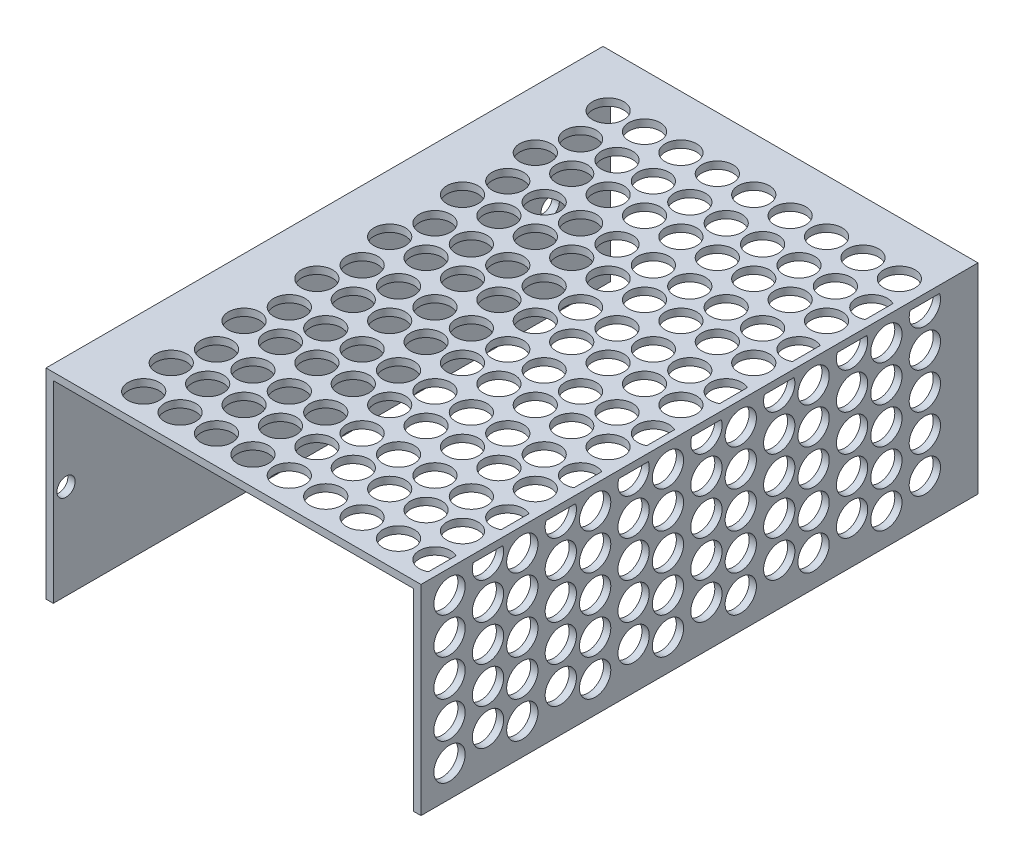
from build123d import *

# Parameters (mm, degrees)
EXTRUDE_1_DEPTH       = 78.5
CUT_EXTRUDE_1_DEPTH   = 99.116002772
SKETCH_3_R            = 2.15
CUT_EXTRUDE_2_DEPTH   = 10
HOLE_WIZARD_M31_D     = 2.5
HOLE_WIZARD_M31_DEPTH = 8.5
HOLE_WIZARD_M31_TIP   = 0.751075774
SKETCH_6_R            = 2.15
CUT_EXTRUDE_3_DEPTH   = 24


with BuildPart() as part:
    # Эскиз1 → Бобышка-Вытянуть1 (new body)
    with BuildSketch(Plane.XY):
        Polygon((50.5, 0), (50.5, 27.5), (1, 27.5), (1, 0), (0, 0), (0, 28.5), (51.5, 28.5), (51.5, 0), align=None)
    extrude(amount=EXTRUDE_1_DEPTH)

    # Эскиз2 → Вырез-Вытянуть1 (cut, through all)
    with BuildSketch(Plane(origin=(51.5, 0, 0), x_dir=(0, 0, -1), z_dir=(1, 0, 0))):
        Polygon((-77.5, 28.5), (-77.5, 1), (-1, 1), (-1, 28.5), (0, 28.5), (0, 0), (-78.5, 0), (-78.5, 28.5), align=None)
    extrude(amount=-CUT_EXTRUDE_1_DEPTH, mode=Mode.SUBTRACT)

    # Эскиз3 → Вырез-Вытянуть2 (cut)
    with BuildSketch(Plane(origin=(0, 28.5, 0), x_dir=(1, 0, 0), z_dir=(0, 1, 0))):
        with Locations(Location((8, -8.3, 0), (0, 0, 270))):
            Circle(SKETCH_3_R)
        with Locations(Location((9.5, -13.582039862, 0), (0, 0, 270))):
            Circle(SKETCH_3_R)
        with Locations(Location((13, -8.3, 0), (0, 0, 270))):
            Circle(SKETCH_3_R)
        with Locations(Location((14.5, -13.582039862, 0), (0, 0, 270))):
            Circle(SKETCH_3_R)
        with Locations(Location((18, -8.3, 0), (0, 0, 270))):
            Circle(SKETCH_3_R)
        with Locations(Location((19.5, -13.582039862, 0), (0, 0, 270))):
            Circle(SKETCH_3_R)
        with Locations(Location((23, -8.3, 0), (0, 0, 270))):
            Circle(SKETCH_3_R)
        with Locations(Location((24.5, -13.582039862, 0), (0, 0, 270))):
            Circle(SKETCH_3_R)
        with Locations(Location((28, -8.3, 0), (0, 0, 270))):
            Circle(SKETCH_3_R)
        with Locations(Location((29.5, -13.582039862, 0), (0, 0, 270))):
            Circle(SKETCH_3_R)
        with Locations(Location((33, -8.3, 0), (0, 0, 270))):
            Circle(SKETCH_3_R)
        with Locations(Location((34.5, -13.582039862, 0), (0, 0, 270))):
            Circle(SKETCH_3_R)
        with Locations(Location((38, -8.3, 0), (0, 0, 270))):
            Circle(SKETCH_3_R)
        with Locations(Location((39.5, -13.582039862, 0), (0, 0, 270))):
            Circle(SKETCH_3_R)
        with Locations(Location((43, -8.3, 0), (0, 0, 270))):
            Circle(SKETCH_3_R)
        with Locations(Location((44.5, -13.582039862, 0), (0, 0, 270))):
            Circle(SKETCH_3_R)
        with Locations(Location((48, -8.3, 0), (0, 0, 270))):
            Circle(SKETCH_3_R)
        with Locations(Location((8, -18.3, 0), (0, 0, 270))):
            Circle(SKETCH_3_R)
        with Locations(Location((9.5, -23.582039862, 0), (0, 0, 270))):
            Circle(SKETCH_3_R)
        with Locations(Location((13, -18.3, 0), (0, 0, 270))):
            Circle(SKETCH_3_R)
        with Locations(Location((14.5, -23.582039862, 0), (0, 0, 270))):
            Circle(SKETCH_3_R)
        with Locations(Location((18, -18.3, 0), (0, 0, 270))):
            Circle(SKETCH_3_R)
        with Locations(Location((19.5, -23.582039862, 0), (0, 0, 270))):
            Circle(SKETCH_3_R)
        with Locations(Location((23, -18.3, 0), (0, 0, 270))):
            Circle(SKETCH_3_R)
        with Locations(Location((24.5, -23.582039862, 0), (0, 0, 270))):
            Circle(SKETCH_3_R)
        with Locations(Location((28, -18.3, 0), (0, 0, 270))):
            Circle(SKETCH_3_R)
        with Locations(Location((29.5, -23.582039862, 0), (0, 0, 270))):
            Circle(SKETCH_3_R)
        with Locations(Location((33, -18.3, 0), (0, 0, 270))):
            Circle(SKETCH_3_R)
        with Locations(Location((34.5, -23.582039862, 0), (0, 0, 270))):
            Circle(SKETCH_3_R)
        with Locations(Location((38, -18.3, 0), (0, 0, 270))):
            Circle(SKETCH_3_R)
        with Locations(Location((39.5, -23.582039862, 0), (0, 0, 270))):
            Circle(SKETCH_3_R)
        with Locations(Location((43, -18.3, 0), (0, 0, 270))):
            Circle(SKETCH_3_R)
        with Locations(Location((44.5, -23.582039862, 0), (0, 0, 270))):
            Circle(SKETCH_3_R)
        with Locations(Location((48, -18.3, 0), (0, 0, 270))):
            Circle(SKETCH_3_R)
        with Locations(Location((8, -28.3, 0), (0, 0, 270))):
            Circle(SKETCH_3_R)
        with Locations(Location((9.5, -33.582039862, 0), (0, 0, 270))):
            Circle(SKETCH_3_R)
        with Locations(Location((13, -28.3, 0), (0, 0, 270))):
            Circle(SKETCH_3_R)
        with Locations(Location((14.5, -33.582039862, 0), (0, 0, 270))):
            Circle(SKETCH_3_R)
        with Locations(Location((18, -28.3, 0), (0, 0, 270))):
            Circle(SKETCH_3_R)
        with Locations(Location((19.5, -33.582039862, 0), (0, 0, 270))):
            Circle(SKETCH_3_R)
        with Locations(Location((23, -28.3, 0), (0, 0, 270))):
            Circle(SKETCH_3_R)
        with Locations(Location((24.5, -33.582039862, 0), (0, 0, 270))):
            Circle(SKETCH_3_R)
        with Locations(Location((28, -28.3, 0), (0, 0, 270))):
            Circle(SKETCH_3_R)
        with Locations(Location((29.5, -33.582039862, 0), (0, 0, 270))):
            Circle(SKETCH_3_R)
        with Locations(Location((33, -28.3, 0), (0, 0, 270))):
            Circle(SKETCH_3_R)
        with Locations(Location((34.5, -33.582039862, 0), (0, 0, 270))):
            Circle(SKETCH_3_R)
        with Locations(Location((38, -28.3, 0), (0, 0, 270))):
            Circle(SKETCH_3_R)
        with Locations(Location((39.5, -33.582039862, 0), (0, 0, 270))):
            Circle(SKETCH_3_R)
        with Locations(Location((43, -28.3, 0), (0, 0, 270))):
            Circle(SKETCH_3_R)
        with Locations(Location((44.5, -33.582039862, 0), (0, 0, 270))):
            Circle(SKETCH_3_R)
        with Locations(Location((48, -28.3, 0), (0, 0, 270))):
            Circle(SKETCH_3_R)
        with Locations(Location((8, -38.3, 0), (0, 0, 270))):
            Circle(SKETCH_3_R)
        with Locations(Location((9.5, -43.582039862, 0), (0, 0, 270))):
            Circle(SKETCH_3_R)
        with Locations(Location((13, -38.3, 0), (0, 0, 270))):
            Circle(SKETCH_3_R)
        with Locations(Location((14.5, -43.582039862, 0), (0, 0, 270))):
            Circle(SKETCH_3_R)
        with Locations(Location((18, -38.3, 0), (0, 0, 270))):
            Circle(SKETCH_3_R)
        with Locations(Location((19.5, -43.582039862, 0), (0, 0, 270))):
            Circle(SKETCH_3_R)
        with Locations(Location((23, -38.3, 0), (0, 0, 270))):
            Circle(SKETCH_3_R)
        with Locations(Location((24.5, -43.582039862, 0), (0, 0, 270))):
            Circle(SKETCH_3_R)
        with Locations(Location((28, -38.3, 0), (0, 0, 270))):
            Circle(SKETCH_3_R)
        with Locations(Location((29.5, -43.582039862, 0), (0, 0, 270))):
            Circle(SKETCH_3_R)
        with Locations(Location((33, -38.3, 0), (0, 0, 270))):
            Circle(SKETCH_3_R)
        with Locations(Location((34.5, -43.582039862, 0), (0, 0, 270))):
            Circle(SKETCH_3_R)
        with Locations(Location((38, -38.3, 0), (0, 0, 270))):
            Circle(SKETCH_3_R)
        with Locations(Location((39.5, -43.582039862, 0), (0, 0, 270))):
            Circle(SKETCH_3_R)
        with Locations(Location((43, -38.3, 0), (0, 0, 270))):
            Circle(SKETCH_3_R)
        with Locations(Location((44.5, -43.582039862, 0), (0, 0, 270))):
            Circle(SKETCH_3_R)
        with Locations(Location((48, -38.3, 0), (0, 0, 270))):
            Circle(SKETCH_3_R)
        with Locations(Location((8, -48.3, 0), (0, 0, 270))):
            Circle(SKETCH_3_R)
        with Locations(Location((9.5, -53.582039862, 0), (0, 0, 270))):
            Circle(SKETCH_3_R)
        with Locations(Location((13, -48.3, 0), (0, 0, 270))):
            Circle(SKETCH_3_R)
        with Locations(Location((14.5, -53.582039862, 0), (0, 0, 270))):
            Circle(SKETCH_3_R)
        with Locations(Location((18, -48.3, 0), (0, 0, 270))):
            Circle(SKETCH_3_R)
        with Locations(Location((19.5, -53.582039862, 0), (0, 0, 270))):
            Circle(SKETCH_3_R)
        with Locations(Location((23, -48.3, 0), (0, 0, 270))):
            Circle(SKETCH_3_R)
        with Locations(Location((24.5, -53.582039862, 0), (0, 0, 270))):
            Circle(SKETCH_3_R)
        with Locations(Location((28, -48.3, 0), (0, 0, 270))):
            Circle(SKETCH_3_R)
        with Locations(Location((29.5, -53.582039862, 0), (0, 0, 270))):
            Circle(SKETCH_3_R)
        with Locations(Location((33, -48.3, 0), (0, 0, 270))):
            Circle(SKETCH_3_R)
        with Locations(Location((34.5, -53.582039862, 0), (0, 0, 270))):
            Circle(SKETCH_3_R)
        with Locations(Location((38, -48.3, 0), (0, 0, 270))):
            Circle(SKETCH_3_R)
        with Locations(Location((39.5, -53.582039862, 0), (0, 0, 270))):
            Circle(SKETCH_3_R)
        with Locations(Location((43, -48.3, 0), (0, 0, 270))):
            Circle(SKETCH_3_R)
        with Locations(Location((44.5, -53.582039862, 0), (0, 0, 270))):
            Circle(SKETCH_3_R)
        with Locations(Location((48, -48.3, 0), (0, 0, 270))):
            Circle(SKETCH_3_R)
        with Locations(Location((8, -58.3, 0), (0, 0, 270))):
            Circle(SKETCH_3_R)
        with Locations(Location((9.5, -63.582039862, 0), (0, 0, 270))):
            Circle(SKETCH_3_R)
        with Locations(Location((13, -58.3, 0), (0, 0, 270))):
            Circle(SKETCH_3_R)
        with Locations(Location((14.5, -63.582039862, 0), (0, 0, 270))):
            Circle(SKETCH_3_R)
        with Locations(Location((18, -58.3, 0), (0, 0, 270))):
            Circle(SKETCH_3_R)
        with Locations(Location((19.5, -63.582039862, 0), (0, 0, 270))):
            Circle(SKETCH_3_R)
        with Locations(Location((23, -58.3, 0), (0, 0, 270))):
            Circle(SKETCH_3_R)
        with Locations(Location((24.5, -63.582039862, 0), (0, 0, 270))):
            Circle(SKETCH_3_R)
        with Locations(Location((28, -58.3, 0), (0, 0, 270))):
            Circle(SKETCH_3_R)
        with Locations(Location((29.5, -63.582039862, 0), (0, 0, 270))):
            Circle(SKETCH_3_R)
        with Locations(Location((33, -58.3, 0), (0, 0, 270))):
            Circle(SKETCH_3_R)
        with Locations(Location((34.5, -63.582039862, 0), (0, 0, 270))):
            Circle(SKETCH_3_R)
        with Locations(Location((38, -58.3, 0), (0, 0, 270))):
            Circle(SKETCH_3_R)
        with Locations(Location((39.5, -63.582039862, 0), (0, 0, 270))):
            Circle(SKETCH_3_R)
        with Locations(Location((43, -58.3, 0), (0, 0, 270))):
            Circle(SKETCH_3_R)
        with Locations(Location((44.5, -63.582039862, 0), (0, 0, 270))):
            Circle(SKETCH_3_R)
        with Locations(Location((48, -58.3, 0), (0, 0, 270))):
            Circle(SKETCH_3_R)
        with Locations(Location((8, -68.3, 0), (0, 0, 270))):
            Circle(SKETCH_3_R)
        with Locations(Location((9.5, -73.582039862, 0), (0, 0, 270))):
            Circle(SKETCH_3_R)
        with Locations(Location((13, -68.3, 0), (0, 0, 270))):
            Circle(SKETCH_3_R)
        with Locations(Location((14.5, -73.582039862, 0), (0, 0, 270))):
            Circle(SKETCH_3_R)
        with Locations(Location((18, -68.3, 0), (0, 0, 270))):
            Circle(SKETCH_3_R)
        with Locations(Location((19.5, -73.582039862, 0), (0, 0, 270))):
            Circle(SKETCH_3_R)
        with Locations(Location((23, -68.3, 0), (0, 0, 270))):
            Circle(SKETCH_3_R)
        with Locations(Location((24.5, -73.582039862, 0), (0, 0, 270))):
            Circle(SKETCH_3_R)
        with Locations(Location((28, -68.3, 0), (0, 0, 270))):
            Circle(SKETCH_3_R)
        with Locations(Location((29.5, -73.582039862, 0), (0, 0, 270))):
            Circle(SKETCH_3_R)
        with Locations(Location((33, -68.3, 0), (0, 0, 270))):
            Circle(SKETCH_3_R)
        with Locations(Location((34.5, -73.582039862, 0), (0, 0, 270))):
            Circle(SKETCH_3_R)
        with Locations(Location((38, -68.3, 0), (0, 0, 270))):
            Circle(SKETCH_3_R)
        with Locations(Location((39.5, -73.582039862, 0), (0, 0, 270))):
            Circle(SKETCH_3_R)
        with Locations(Location((43, -68.3, 0), (0, 0, 270))):
            Circle(SKETCH_3_R)
        with Locations(Location((44.5, -73.582039862, 0), (0, 0, 270))):
            Circle(SKETCH_3_R)
        with Locations(Location((48, -68.3, 0), (0, 0, 270))):
            Circle(SKETCH_3_R)
        with BuildLine():
            Line((50.5, -21.678753231), (50.5, -25.485326493))
            ThreePointArc((50.5, -25.485326493), (47.35, -23.582039862), (50.5, -21.678753231))
        make_face()
        with BuildLine():
            Line((50.5, -31.678753231), (50.5, -35.485326493))
            ThreePointArc((50.5, -35.485326493), (47.35, -33.582039862), (50.5, -31.678753231))
        make_face()
        with BuildLine():
            Line((50.5, -11.678753231), (50.5, -15.485326493))
            ThreePointArc((50.5, -15.485326493), (47.35, -13.582039862), (50.5, -11.678753231))
        make_face()
        with BuildLine():
            Line((50.5, -41.678753231), (50.5, -45.485326493))
            ThreePointArc((50.5, -45.485326493), (47.35, -43.582039862), (50.5, -41.678753231))
        make_face()
        with BuildLine():
            Line((50.5, -51.678753231), (50.5, -55.485326493))
            ThreePointArc((50.5, -55.485326493), (47.35, -53.582039862), (50.5, -51.678753231))
        make_face()
        with BuildLine():
            Line((50.5, -61.678753231), (50.5, -65.485326493))
            ThreePointArc((50.5, -65.485326493), (47.35, -63.582039862), (50.5, -61.678753231))
        make_face()
        with BuildLine():
            Line((50.5, -71.678753231), (50.5, -75.485326493))
            ThreePointArc((50.5, -75.485326493), (47.35, -73.582039862), (50.5, -71.678753231))
        make_face()
    extrude(amount=-CUT_EXTRUDE_2_DEPTH, mode=Mode.SUBTRACT)

    # Отверстие обработанное метчиком M31
    with Locations(Plane.ZY):
        with Locations((75.75, 14), (9.25, 14)):
            Hole(HOLE_WIZARD_M31_D / 2, depth=HOLE_WIZARD_M31_DEPTH)
            with Locations((0, 0, -(HOLE_WIZARD_M31_DEPTH + HOLE_WIZARD_M31_TIP / 2))):  # 118° drill point
                Cone(0, HOLE_WIZARD_M31_D / 2, HOLE_WIZARD_M31_TIP, mode=Mode.SUBTRACT)

    # Эскиз6 → Вырез-Вытянуть3 (cut)
    with BuildSketch(Plane(origin=(51.5, 0, 0), x_dir=(0, 0, -1), z_dir=(1, 0, 0))):
        with Locations((-73.58, 5.272663972)):
            Circle(SKETCH_6_R)
        with Locations((-68.297960138, 6.772663972)):
            Circle(SKETCH_6_R)
        with Locations((-73.58, 10.272663972)):
            Circle(SKETCH_6_R)
        with Locations((-68.297960138, 11.772663972)):
            Circle(SKETCH_6_R)
        with Locations((-73.58, 15.272663972)):
            Circle(SKETCH_6_R)
        with Locations((-68.297960138, 16.772663972)):
            Circle(SKETCH_6_R)
        with Locations((-73.58, 20.272663972)):
            Circle(SKETCH_6_R)
        with Locations((-68.297960138, 21.772663972)):
            Circle(SKETCH_6_R)
        with Locations((-73.58, 25.272663972)):
            Circle(SKETCH_6_R)
        with Locations((-63.58, 5.272663972)):
            Circle(SKETCH_6_R)
        with Locations((-58.297960138, 6.772663972)):
            Circle(SKETCH_6_R)
        with Locations((-63.58, 10.272663972)):
            Circle(SKETCH_6_R)
        with Locations((-58.297960138, 11.772663972)):
            Circle(SKETCH_6_R)
        with Locations((-63.58, 15.272663972)):
            Circle(SKETCH_6_R)
        with Locations((-58.297960138, 16.772663972)):
            Circle(SKETCH_6_R)
        with Locations((-63.58, 20.272663972)):
            Circle(SKETCH_6_R)
        with Locations((-58.297960138, 21.772663972)):
            Circle(SKETCH_6_R)
        with Locations((-63.58, 25.272663972)):
            Circle(SKETCH_6_R)
        with Locations((-53.58, 5.272663972)):
            Circle(SKETCH_6_R)
        with Locations((-48.297960138, 6.772663972)):
            Circle(SKETCH_6_R)
        with Locations((-53.58, 10.272663972)):
            Circle(SKETCH_6_R)
        with Locations((-48.297960138, 11.772663972)):
            Circle(SKETCH_6_R)
        with Locations((-53.58, 15.272663972)):
            Circle(SKETCH_6_R)
        with Locations((-48.297960138, 16.772663972)):
            Circle(SKETCH_6_R)
        with Locations((-53.58, 20.272663972)):
            Circle(SKETCH_6_R)
        with Locations((-48.297960138, 21.772663972)):
            Circle(SKETCH_6_R)
        with Locations((-53.58, 25.272663972)):
            Circle(SKETCH_6_R)
        with Locations((-43.58, 5.272663972)):
            Circle(SKETCH_6_R)
        with Locations((-38.297960138, 6.772663972)):
            Circle(SKETCH_6_R)
        with Locations((-43.58, 10.272663972)):
            Circle(SKETCH_6_R)
        with Locations((-38.297960138, 11.772663972)):
            Circle(SKETCH_6_R)
        with Locations((-43.58, 15.272663972)):
            Circle(SKETCH_6_R)
        with Locations((-38.297960138, 16.772663972)):
            Circle(SKETCH_6_R)
        with Locations((-43.58, 20.272663972)):
            Circle(SKETCH_6_R)
        with Locations((-38.297960138, 21.772663972)):
            Circle(SKETCH_6_R)
        with Locations((-43.58, 25.272663972)):
            Circle(SKETCH_6_R)
        with Locations((-33.58, 5.272663972)):
            Circle(SKETCH_6_R)
        with Locations((-28.297960138, 6.772663972)):
            Circle(SKETCH_6_R)
        with Locations((-33.58, 10.272663972)):
            Circle(SKETCH_6_R)
        with Locations((-28.297960138, 11.772663972)):
            Circle(SKETCH_6_R)
        with Locations((-33.58, 15.272663972)):
            Circle(SKETCH_6_R)
        with Locations((-28.297960138, 16.772663972)):
            Circle(SKETCH_6_R)
        with Locations((-33.58, 20.272663972)):
            Circle(SKETCH_6_R)
        with Locations((-28.297960138, 21.772663972)):
            Circle(SKETCH_6_R)
        with Locations((-33.58, 25.272663972)):
            Circle(SKETCH_6_R)
        with Locations((-23.58, 5.272663972)):
            Circle(SKETCH_6_R)
        with Locations((-18.297960138, 6.772663972)):
            Circle(SKETCH_6_R)
        with Locations((-23.58, 10.272663972)):
            Circle(SKETCH_6_R)
        with Locations((-18.297960138, 11.772663972)):
            Circle(SKETCH_6_R)
        with Locations((-23.58, 15.272663972)):
            Circle(SKETCH_6_R)
        with Locations((-18.297960138, 16.772663972)):
            Circle(SKETCH_6_R)
        with Locations((-23.58, 20.272663972)):
            Circle(SKETCH_6_R)
        with Locations((-18.297960138, 21.772663972)):
            Circle(SKETCH_6_R)
        with Locations((-23.58, 25.272663972)):
            Circle(SKETCH_6_R)
        with Locations((-13.58, 5.272663972)):
            Circle(SKETCH_6_R)
        with Locations((-8.297960138, 6.772663972)):
            Circle(SKETCH_6_R)
        with Locations((-13.58, 10.272663972)):
            Circle(SKETCH_6_R)
        with Locations((-8.297960138, 11.772663972)):
            Circle(SKETCH_6_R)
        with Locations((-13.58, 15.272663972)):
            Circle(SKETCH_6_R)
        with Locations((-8.297960138, 16.772663972)):
            Circle(SKETCH_6_R)
        with Locations((-13.58, 20.272663972)):
            Circle(SKETCH_6_R)
        with Locations((-8.297960138, 21.772663972)):
            Circle(SKETCH_6_R)
        with Locations((-13.58, 25.272663972)):
            Circle(SKETCH_6_R)
        with BuildLine():
            Line((-60.32119574, 27.5), (-56.274724535, 27.5))
            ThreePointArc((-56.274724535, 27.5), (-58.297960138, 24.622663972), (-60.32119574, 27.5))
        make_face()
        with BuildLine():
            Line((-70.32119574, 27.5), (-66.274724535, 27.5))
            ThreePointArc((-66.274724535, 27.5), (-68.297960138, 24.622663972), (-70.32119574, 27.5))
        make_face()
        with BuildLine():
            Line((-50.32119574, 27.5), (-46.274724535, 27.5))
            ThreePointArc((-46.274724535, 27.5), (-48.297960138, 24.622663972), (-50.32119574, 27.5))
        make_face()
        with BuildLine():
            Line((-40.32119574, 27.5), (-36.274724535, 27.5))
            ThreePointArc((-36.274724535, 27.5), (-38.297960138, 24.622663972), (-40.32119574, 27.5))
        make_face()
        with BuildLine():
            Line((-30.32119574, 27.5), (-26.274724535, 27.5))
            ThreePointArc((-26.274724535, 27.5), (-28.297960138, 24.622663972), (-30.32119574, 27.5))
        make_face()
        with BuildLine():
            Line((-20.32119574, 27.5), (-16.274724535, 27.5))
            ThreePointArc((-16.274724535, 27.5), (-18.297960138, 24.622663972), (-20.32119574, 27.5))
        make_face()
        with BuildLine():
            Line((-10.32119574, 27.5), (-6.274724535, 27.5))
            ThreePointArc((-6.274724535, 27.5), (-8.297960138, 24.622663972), (-10.32119574, 27.5))
        make_face()
    extrude(amount=-CUT_EXTRUDE_3_DEPTH, mode=Mode.SUBTRACT)


solid = part.part
